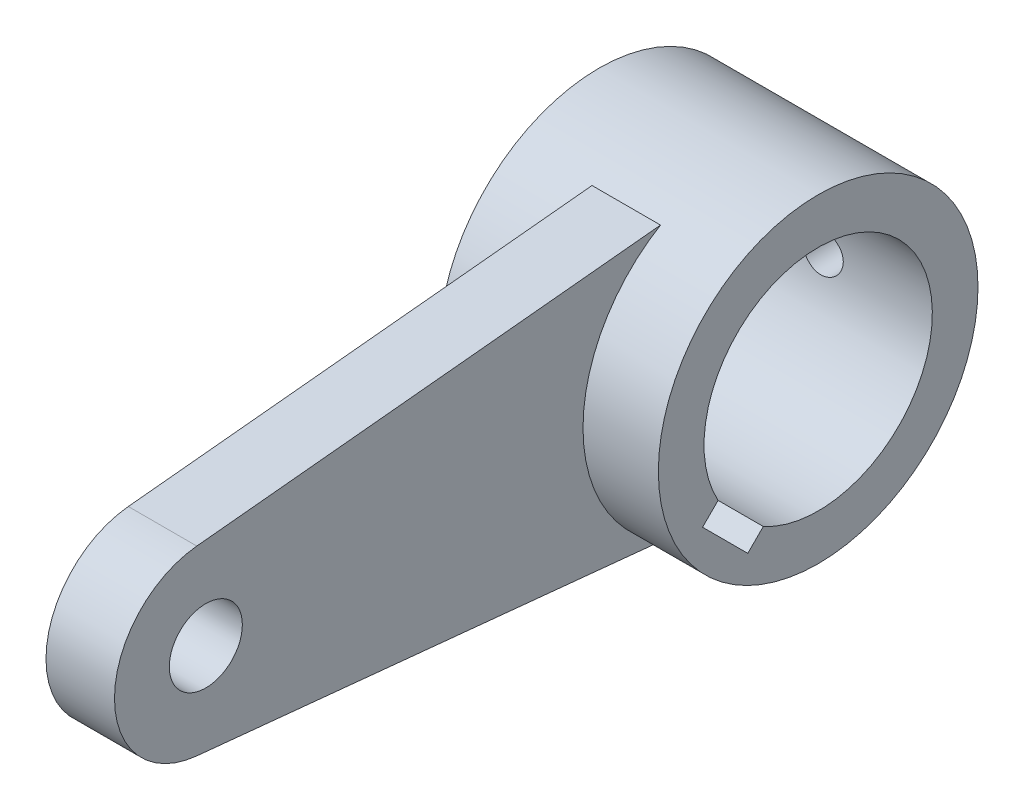
from build123d import *

# Parameters (mm, degrees)
SKETCH1_R           = 35
SKETCH1_R_2         = 25
BOSS_EXTRUDE1_DEPTH = 24
BOSS_EXTRUDE2_DEPTH = 7.5
SKETCH3_R           = 8
CUT_EXTRUDE1_DEPTH  = 15
CUT_EXTRUDE2_DEPTH  = 150.875815261
SKETCH6_R           = 4.5
CUT_EXTRUDE3_DEPTH  = 24


with BuildPart() as part:
    # Sketch1 → Boss-Extrude1 (new, symmetric)
    with BuildSketch(Plane(origin=(0, 0, 0), x_dir=(0, 0, -1), z_dir=(1, 0, 0))):
        Circle(SKETCH1_R)
        Circle(SKETCH1_R_2, mode=Mode.SUBTRACT)
    extrude(amount=BOSS_EXTRUDE1_DEPTH, both=True)

    # Sketch2 → Boss-Extrude2 (add, symmetric)
    with BuildSketch(Plane(origin=(0, 0, 0), x_dir=(0, 0, -1), z_dir=(1, 0, 0))):
        with BuildLine():
            Line((-18.027756377, 30), (-119.579019246, 19.901846216))
            ThreePointArc((-119.579019246, 19.901846216), (-137.6, 0), (-119.579019246, -19.901846216))
            Line((-119.579019246, -19.901846216), (-18.027756377, -30))
            ThreePointArc((-18.027756377, -30), (-35, 0), (-18.027756377, 30))
        make_face()
    extrude(amount=BOSS_EXTRUDE2_DEPTH, both=True)

    # Sketch3 → Cut-Extrude1 (cut)
    with BuildSketch(Plane(origin=(7.5, 0, 0), x_dir=(0, 0, -1), z_dir=(1, 0, 0))):
        with Locations((-117.6, 0)):
            Circle(SKETCH3_R)
    extrude(amount=-CUT_EXTRUDE1_DEPTH, mode=Mode.SUBTRACT)

    # Sketch5 → Cut-Extrude2 (cut, through all)
    with BuildSketch(Plane(origin=(24, 0, 0), x_dir=(0, 0, -1), z_dir=(1, 0, 0))):
        Polygon((-3.702856162, 6.196638775), (-25.314422766, -15.41492783), (-15.41492783, -25.314422766), (6.196638775, -3.702856162), align=None)
    extrude(amount=-CUT_EXTRUDE2_DEPTH, mode=Mode.SUBTRACT)

    # Sketch6 → Cut-Extrude3 (cut)
    with BuildSketch(Plane.XY.offset(-35)):
        with Locations(Location((0, 0, 0), (0, 0, 180))):
            Circle(SKETCH6_R)
    extrude(amount=CUT_EXTRUDE3_DEPTH, mode=Mode.SUBTRACT)


solid = part.part
